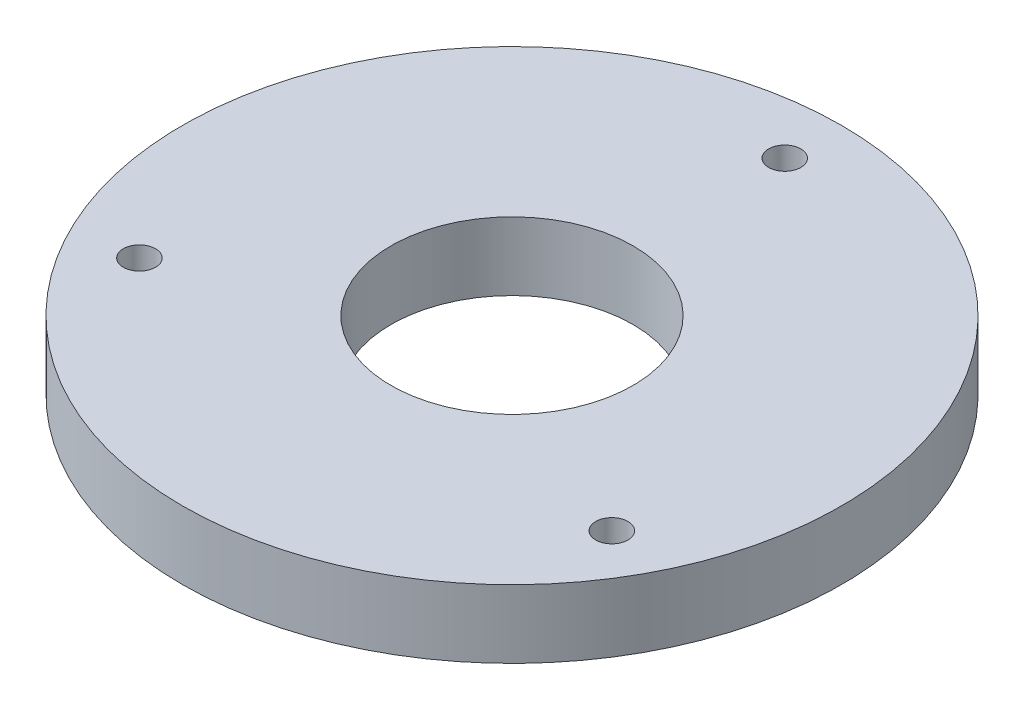
from build123d import *

# Parameters (mm, degrees)
SKETCH1_R            = 36.83
SKETCH1_R_2          = 13.5255
BOSS_EXTRUDE1_DEPTH  = 7.62
M3_CLEARANCE_HOLE1_D = 3.6


with BuildPart() as part:
    # Sketch1 → Boss-Extrude1 (new body)
    with BuildSketch(Plane(origin=(0, 0, 0), x_dir=(1, 0, 0), z_dir=(0, 1, 0))):
        with Locations(Location((0, 0, 0), (0, 0, 90))):
            Circle(SKETCH1_R)
        with Locations(Location((0, 0, 0), (0, 0, 90))):
            Circle(SKETCH1_R_2, mode=Mode.SUBTRACT)
    extrude(amount=BOSS_EXTRUDE1_DEPTH)

    # M3 Clearance Hole1 (through all)
    with Locations(Plane(origin=(0, 7.62, 0), x_dir=(1, 0, 0), z_dir=(0, 1, 0))):
        with Locations((0, 30.48), (26.396454307, -15.24), (-26.396454307, -15.24)):
            Hole(M3_CLEARANCE_HOLE1_D / 2)


solid = part.part
